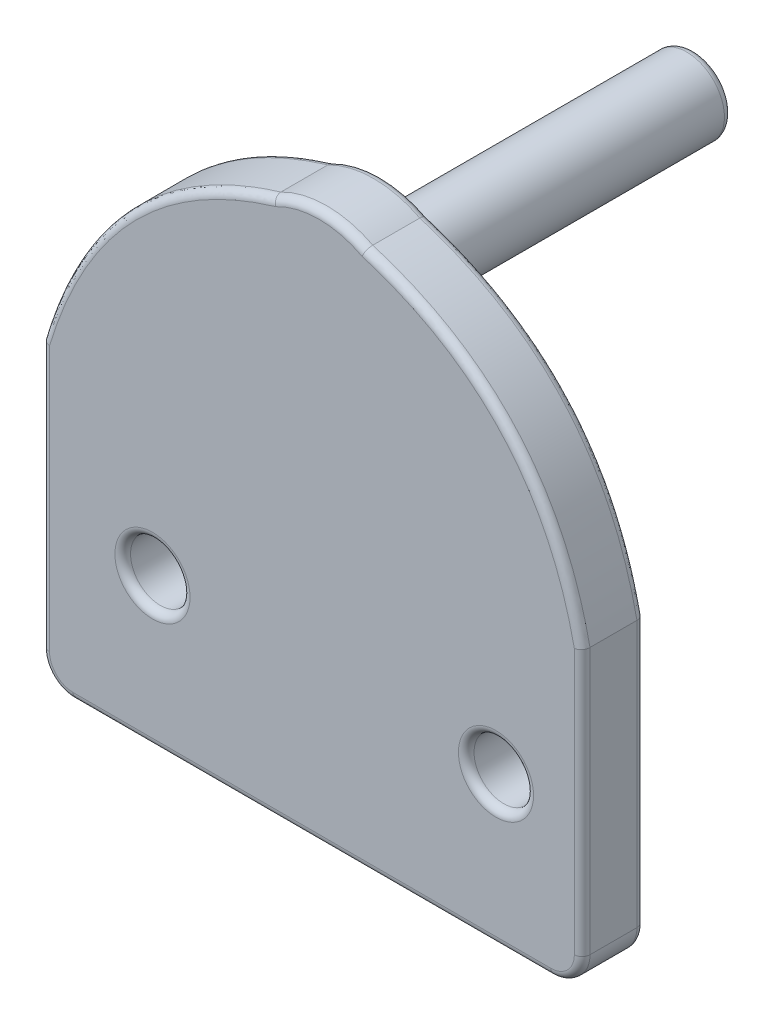
from build123d import *

# Parameters (mm, degrees)
SKETCH1_R           = 1.9
BOSS_EXTRUDE1_DEPTH = 4
SKETCH2_R           = 2.4
BOSS_EXTRUDE2_DEPTH = 20
FILLET1_R           = 1
FILLET2_R           = 0.5
FILLET3_R           = 0.5


with BuildPart() as part:
    # Sketch1 → Boss-Extrude1 (new body)
    with BuildSketch(Plane.XY):
        with BuildLine():
            Line((66.370081612, 9.5), (66.370081612, -7.5))
            ThreePointArc((66.370081612, -7.5), (66.955868049, -8.914213562), (68.370081612, -9.5))
            Line((68.370081612, -9.5), (98.895693861, -9.5))
            ThreePointArc((98.895693861, -9.5), (100.309907424, -8.914213562), (100.895693861, -7.5))
            Line((100.895693861, -7.5), (100.895693861, 9.5))
            add(Edge.make_bspline(
                [(87.024920825, 24.819818705), (98.425633532, 21.330469264), (100.895693861, 9.5)],
                knots=[0, 0, 0, 1, 1, 1], degree=2))
            ThreePointArc((87.024920825, 24.819818705), (84.08544, 25.534798698), (81.145959175, 24.819818705))
            add(Edge.make_bspline(
                [(81.145959175, 24.819818705), (69.943850381, 21.456565506), (66.370081612, 9.5)],
                knots=[0, 0, 0, 1, 1, 1], degree=2))
        make_face()
        with Locations((73.445544057, 0)):
            Circle(SKETCH1_R, mode=Mode.SUBTRACT)
        with Locations((95.389113249, 0)):
            Circle(SKETCH1_R, mode=Mode.SUBTRACT)
    extrude(amount=BOSS_EXTRUDE1_DEPTH)

    # Sketch2 → Boss-Extrude2 (add)
    with BuildSketch(Plane(origin=(0, 0, 0), x_dir=(-1, 0, 0), z_dir=(0, 0, -1))):
        with Locations(Location((-84.08544, 20.132764283, 0), (0, 0, 180))):
            Circle(SKETCH2_R)
    extrude(amount=BOSS_EXTRUDE2_DEPTH)

    # Fillet1
    fillet1_edges = [part.edges().sort_by_distance(p)[0] for p in [
        (81.68544, 20.132764283, 0),
    ]]
    fillet(fillet1_edges, radius=FILLET1_R)

    # Fillet2
    fillet2_edges = [part.edges().sort_by_distance(p)[0] for p in [
        (81.68544, 20.132764283, -20),
    ]]
    fillet(fillet2_edges, radius=FILLET2_R)

    # Fillet3
    fillet3_edges = [part.edges().sort_by_distance(p)[0] for p in [
        (66.370081612, 1, 0),
        (71.707163977, 19.157595114, 0),
        (84.08544, 25.534798698, 0),
        (96.222295901, 19.212718692, 0),
        (71.707163977, 19.157595114, 4),
        (66.370081612, 1, 4),
        (66.955868049, -8.914213562, 4),
        (93.489113249, 0, 0),
        (93.489113249, 0, 4),
        (83.632887737, -9.5, 4),
        (71.545544057, 0, 0),
        (71.545544057, 0, 4),
        (100.309907424, -8.914213562, 4),
        (100.895693861, 1, 4),
        (96.222295901, 19.212718692, 4),
        (100.895693861, 1, 0),
        (84.08544, 25.534798698, 4),
        (100.309907424, -8.914213562, 0),
        (83.632887737, -9.5, 0),
        (66.955868049, -8.914213562, 0),
    ]]
    fillet(fillet3_edges, radius=FILLET3_R)


solid = part.part
